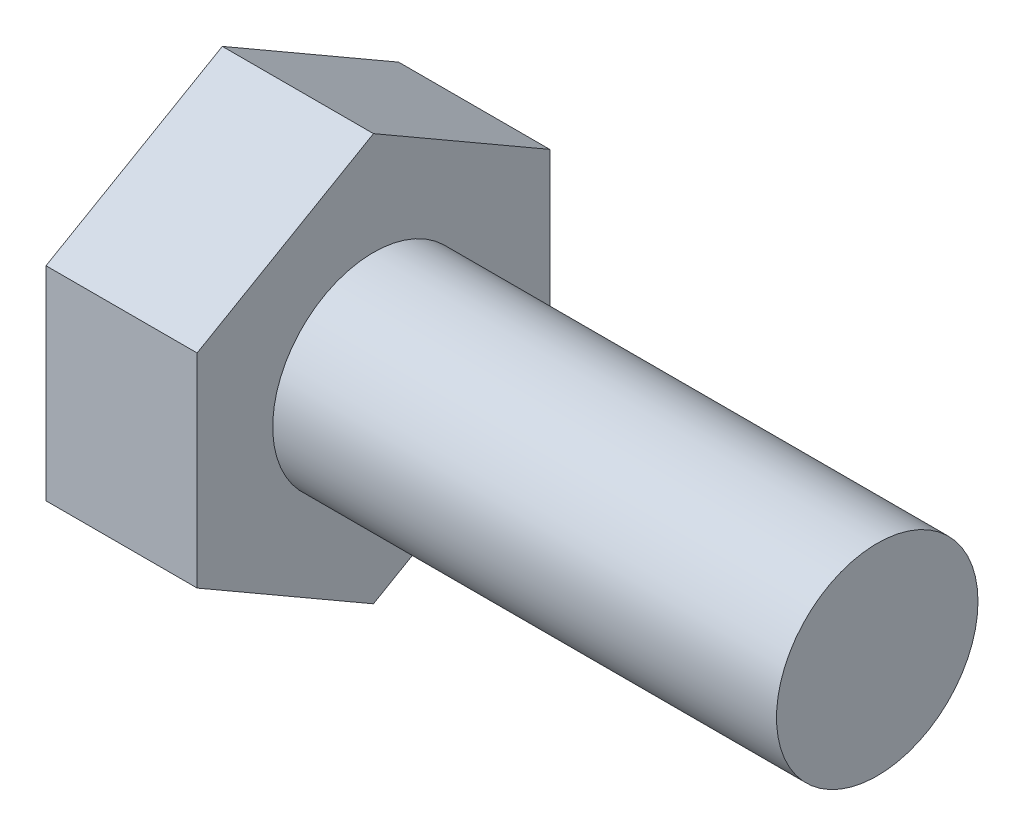
from build123d import *

# Parameters (mm, degrees)
SKETCH1_R            = 2
THREADED_SCREW_DEPTH = 10
HEX_HEAD_DEPTH       = 3


with BuildPart() as part:
    # Sketch1 → Threaded_Screw (new body)
    with BuildSketch(Plane(origin=(0, 0, 0), x_dir=(0, 0, -1), z_dir=(1, 0, 0))):
        Circle(SKETCH1_R)
    extrude(amount=THREADED_SCREW_DEPTH)

    # Sketch2 → Hex_Head (add)
    with BuildSketch(Plane.ZY):
        Polygon((3.5, -2.020725942), (3.5, 2.020725942), (0, 4.041451884), (-3.5, 2.020725942), (-3.5, -2.020725942), (0, -4.041451884), align=None)
    extrude(amount=HEX_HEAD_DEPTH)


solid = part.part
